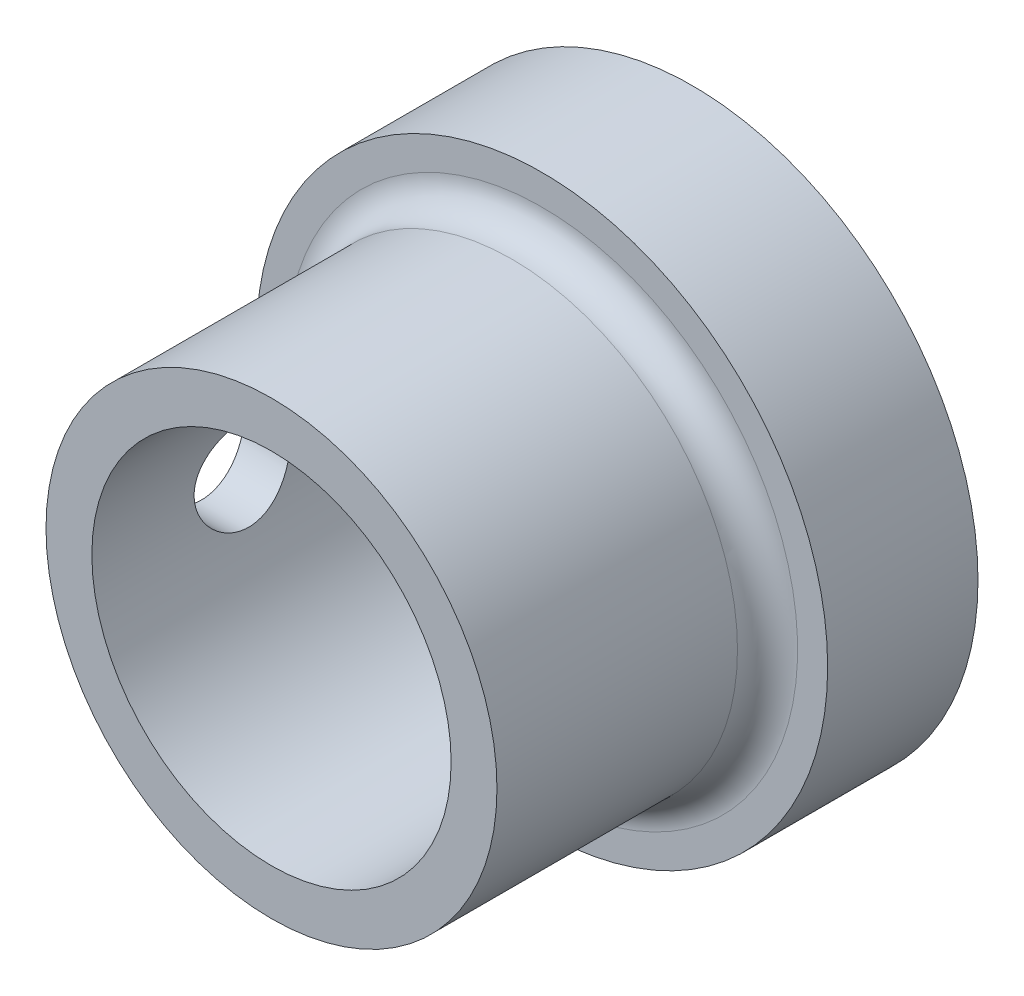
from build123d import *

# Parameters (mm, degrees)
SKETCH2_R           = 7.5
SKETCH2_R_2         = 5.975
BOSS_EXTRUDE1_DEPTH = 9
SKETCH3_R           = 9.5
BOSS_EXTRUDE2_DEPTH = 5
CUT_EXTRUDE1_START  = -5
SKETCH4_R           = 5.975
CUT_EXTRUDE1_DEPTH  = 5
SKETCH5_R           = 1.6
CUT_EXTRUDE2_DEPTH  = 12
FILLET1_R           = 1


with BuildPart() as part:
    # Sketch2 → Boss-Extrude1 (new body)
    with BuildSketch(Plane.XY):
        Circle(SKETCH2_R)
        Circle(SKETCH2_R_2, mode=Mode.SUBTRACT)
    extrude(amount=BOSS_EXTRUDE1_DEPTH)

    # Sketch3 → Boss-Extrude2 (add)
    with BuildSketch(Plane(origin=(0, 0, 0), x_dir=(-1, 0, 0), z_dir=(0, 0, -1))):
        Circle(SKETCH3_R)
    extrude(amount=BOSS_EXTRUDE2_DEPTH)

    # Sketch4 → Cut-Extrude1 (cut)
    with BuildSketch(Plane.XY.offset(CUT_EXTRUDE1_START)):
        Circle(SKETCH4_R)
    extrude(amount=CUT_EXTRUDE1_DEPTH, mode=Mode.SUBTRACT)

    # Sketch5 → Cut-Extrude2 (cut)
    with BuildSketch(Plane.ZY.offset(7.5)):
        with Locations((4, 0)):
            Circle(SKETCH5_R)
    extrude(amount=-CUT_EXTRUDE2_DEPTH, mode=Mode.SUBTRACT)

    # Fillet1
    fillet1_edges = [part.edges().sort_by_distance(p)[0] for p in [
        (-7.5, 0, 0),
    ]]
    fillet(fillet1_edges, radius=FILLET1_R)


solid = part.part
